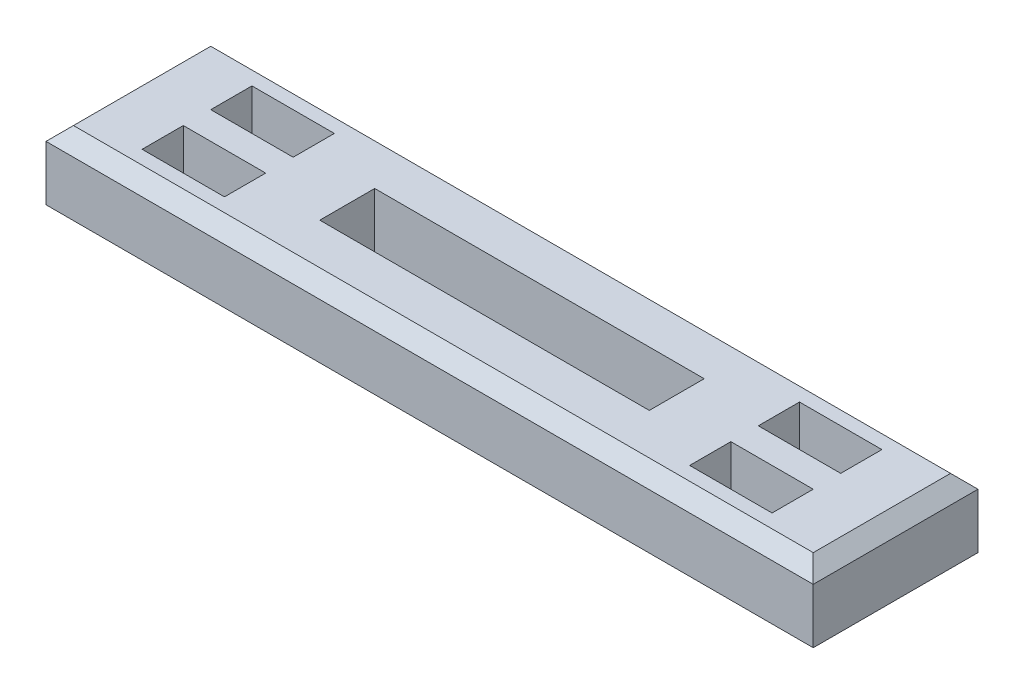
from build123d import *

# Parameters (mm, degrees)
SKETCH_1_W          = 27.94
SKETCH_1_H          = 3
EXTRUDE_2_DEPTH     = 6
SKETCH_2_W          = 3
SKETCH_2_H          = 1.5
CUT_EXTRUDE_1_DEPTH = 6
CHAMFER_1_SIZE      = 0.5
CHAMFER_2_SIZE      = 0.5
SKETCH_3_W          = 12
SKETCH_3_H          = 2
CUT_EXTRUDE_2_DEPTH = 16.49712554


with BuildPart() as part:
    # Эскиз1 → Бобышка-Вытянуть2 (new body)
    with BuildSketch(Plane.XY):
        Rectangle(SKETCH_1_W, SKETCH_1_H)
    extrude(amount=EXTRUDE_2_DEPTH)

    # Эскиз2 → Вырез-Вытянуть1 (cut)
    with BuildSketch(Plane(origin=(0, 1.5, 0), x_dir=(1, 0, 0), z_dir=(0, 1, 0))):
        with Locations((-9.97, -1.75)):
            Rectangle(SKETCH_2_W, SKETCH_2_H)
        with Locations((-9.97, -4.25)):
            Rectangle(SKETCH_2_W, SKETCH_2_H)
        with Locations((9.97, -4.25)):
            Rectangle(SKETCH_2_W, SKETCH_2_H)
        with Locations((9.97, -1.75)):
            Rectangle(SKETCH_2_W, SKETCH_2_H)
    extrude(amount=-CUT_EXTRUDE_1_DEPTH, mode=Mode.SUBTRACT)

    # Фаска1
    chamfer_1_edges = [part.edges().sort_by_distance(p)[0] for p in [
        (0, 1.5, 0),
        (0, 1.5, 6),
        (-13.97, 1.5, 3),
        (13.97, 1.5, 3),
    ]]
    chamfer(chamfer_1_edges, length=CHAMFER_1_SIZE)

    # Фаска2
    chamfer_2_edges = [part.edges().sort_by_distance(p)[0] for p in [
        (0, -1.5, 6),
        (0, -1.5, 0),
        (13.97, -1.5, 3),
        (-13.97, -1.5, 3),
    ]]
    chamfer(chamfer_2_edges, length=CHAMFER_2_SIZE)

    # Эскиз3 → Вырез-Вытянуть2 (cut, through all)
    with BuildSketch(Plane(origin=(0, 1.5, 0), x_dir=(1, 0, 0), z_dir=(0, 1, 0))):
        with Locations((0, -3)):
            Rectangle(SKETCH_3_W, SKETCH_3_H)
    extrude(amount=-CUT_EXTRUDE_2_DEPTH, mode=Mode.SUBTRACT)


solid = part.part
